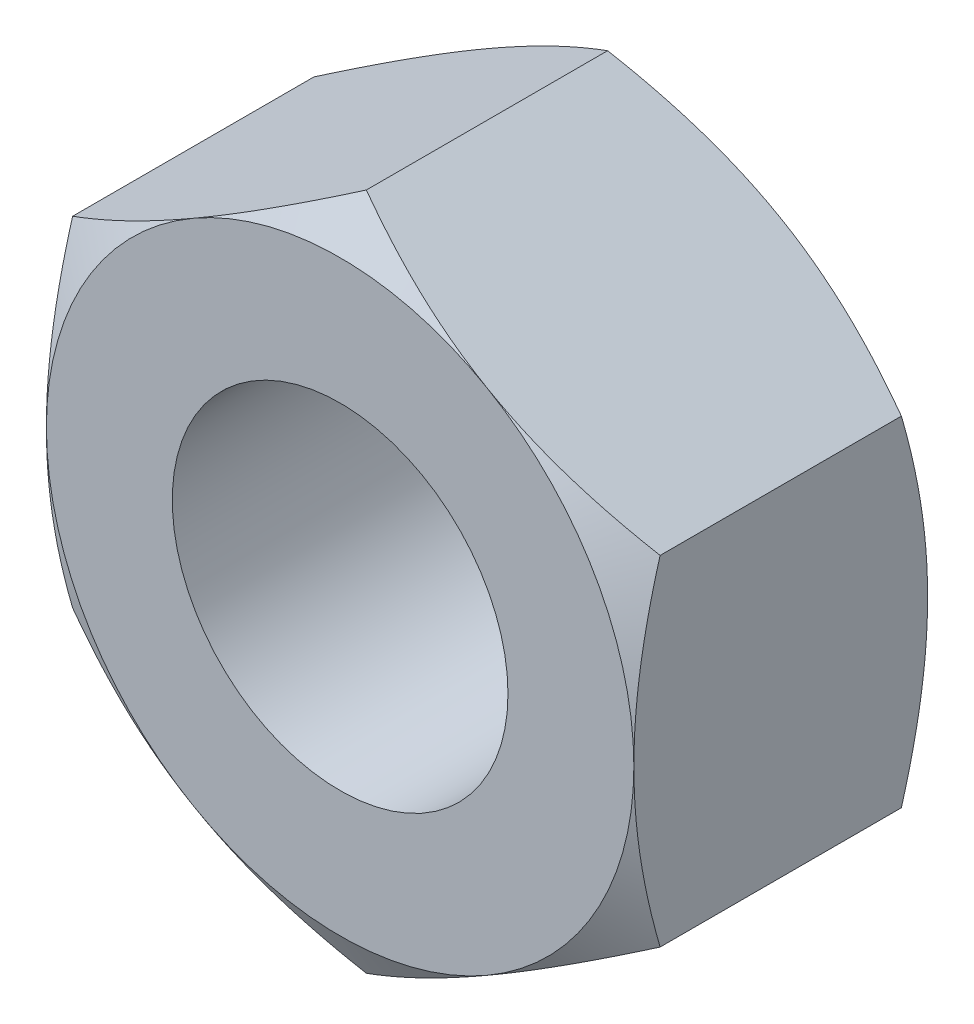
from build123d import *

# Parameters (mm, degrees)
SKETCH1_R               = 3.175
EXTRUDE1_DEPTH          = 2.778125
SKETCH9_OUTSIDE_W       = 55.29
SKETCH9_OUTSIDE_H       = 57.01
SKETCH9_OUTSIDE_R       = 5.55625
CUT_EXTRUDE2_DEPTH      = 11.1442782
CUT_EXTRUDE2_DRAFT      = -60
MIRROR2_COPY_1_SKETCH_W = 55.29
MIRROR2_COPY_1_SKETCH_H = 57.01
MIRROR2_COPY_1_SKETCH_R = 5.55625
MIRROR2_COPY_1_DEPTH    = 11.1442782
MIRROR2_COPY_1_DRAFT    = -60


with BuildPart() as part:
    # Sketch1 → Extrude1 (new, symmetric)
    with BuildSketch(Plane.XY):
        Polygon((-5.55625, 3.207902433), (-5.55625, -3.207902433), (0, -6.415804866), (5.55625, -3.207902433), (5.55625, 3.207902433), (0, 6.415804866), align=None)
        Circle(SKETCH1_R, mode=Mode.SUBTRACT)
    extrude(amount=EXTRUDE1_DEPTH, both=True)


with BuildPart() as cut_extrude2_tool:
    # Sketch9 outside → Cut-Extrude2 (with draft: the straight prism first)
    with BuildSketch(Plane.XY.offset(2.778125)):
        Rectangle(SKETCH9_OUTSIDE_W, SKETCH9_OUTSIDE_H)
        Circle(SKETCH9_OUTSIDE_R, mode=Mode.SUBTRACT)
    extrude(amount=-CUT_EXTRUDE2_DEPTH)
    # Cut-Extrude2: the draft: its side faces are tilted about the plane it starts from
    cut_extrude2_sides = [cut_extrude2_tool.faces().sort_by_distance(p)[0] for p in [
        (0, -28.505, -2.7940141),
        (27.645, 0, -2.7940141),
        (0, 28.505, -2.7940141),
        (-27.645, 0, -2.7940141),
        (-5.55625, 0, -2.7940141),
    ]]
    draft(cut_extrude2_sides, Plane.XY.offset(2.778125), CUT_EXTRUDE2_DRAFT)


with BuildPart() as part_1:
    add(part.part)

    # Cut-Extrude2: cut by cut_extrude2_tool
    add(cut_extrude2_tool.part, mode=Mode.SUBTRACT)


with BuildPart() as mirror2_copy_1_tool:
    # Mirror2 copy 1 sketch → Mirror2 copy 1 (with draft: the straight prism first)
    with BuildSketch(Plane(origin=(0, 0, -2.778125), x_dir=(1, 0, 0), z_dir=(0, 0, -1))):
        Rectangle(MIRROR2_COPY_1_SKETCH_W, MIRROR2_COPY_1_SKETCH_H)
        Circle(MIRROR2_COPY_1_SKETCH_R, mode=Mode.SUBTRACT)
    extrude(amount=-MIRROR2_COPY_1_DEPTH)
    # Mirror2 copy 1: the draft: its side faces are tilted about the plane it starts from
    mirror2_copy_1_sides = [mirror2_copy_1_tool.faces().sort_by_distance(p)[0] for p in [
        (0, -28.505, 2.7940141),
        (27.645, 0, 2.7940141),
        (0, 28.505, 2.7940141),
        (-27.645, 0, 2.7940141),
        (-5.55625, 0, 2.7940141),
    ]]
    draft(mirror2_copy_1_sides, Plane(origin=(0, 0, -2.778125), x_dir=(1, 0, 0), z_dir=(0, 0, -1)), MIRROR2_COPY_1_DRAFT)


with BuildPart() as part_2:
    add(part_1.part)

    # Mirror2 copy 1: cut by mirror2_copy_1_tool
    add(mirror2_copy_1_tool.part, mode=Mode.SUBTRACT)


solid = part_2.part
